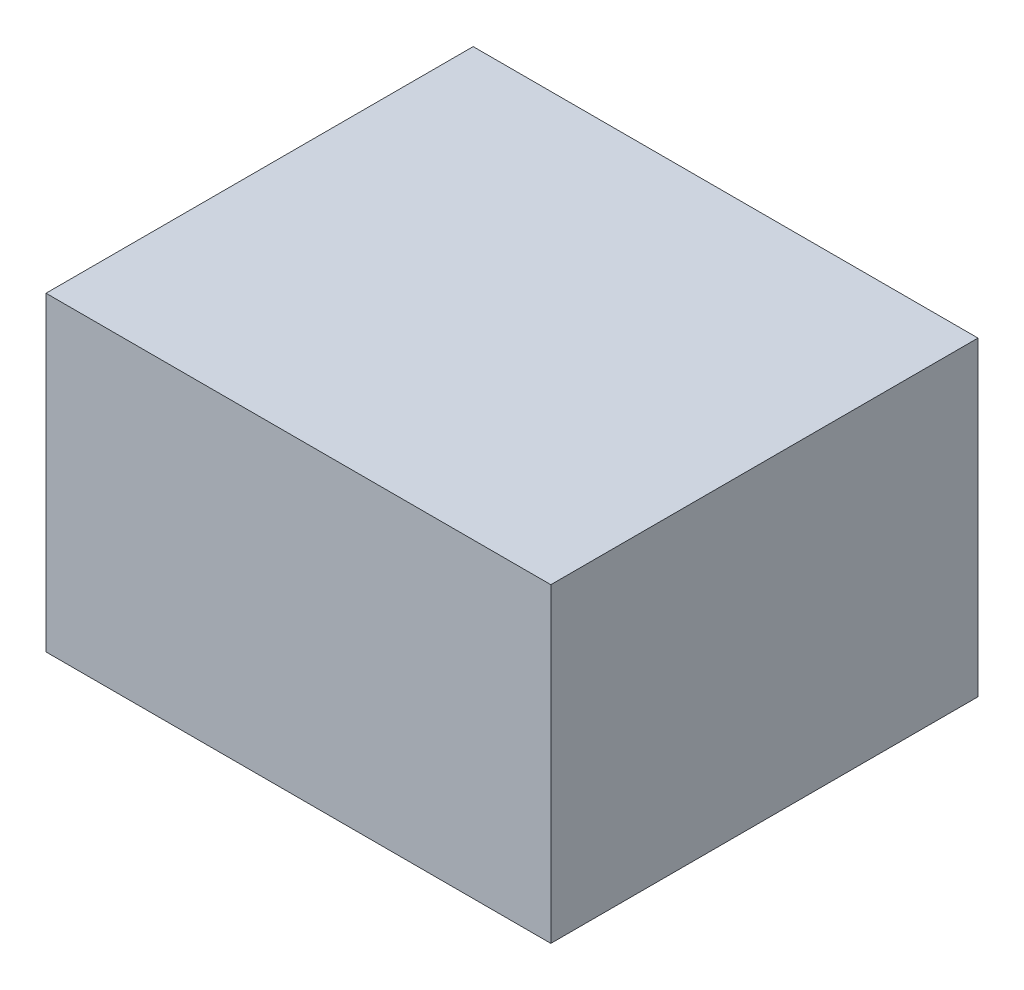
from build123d import *

# Parameters (mm, degrees)
SKETCH_1_W      = 65
SKETCH_1_H      = 55
EXTRUDE_1_DEPTH = 40


with BuildPart() as part:
    # 草图1 → 凸台-拉伸1 (new body)
    with BuildSketch(Plane(origin=(0, 0, 0), x_dir=(1, 0, 0), z_dir=(0, 1, 0))):
        Rectangle(SKETCH_1_W, SKETCH_1_H)
    extrude(amount=EXTRUDE_1_DEPTH)


solid = part.part
